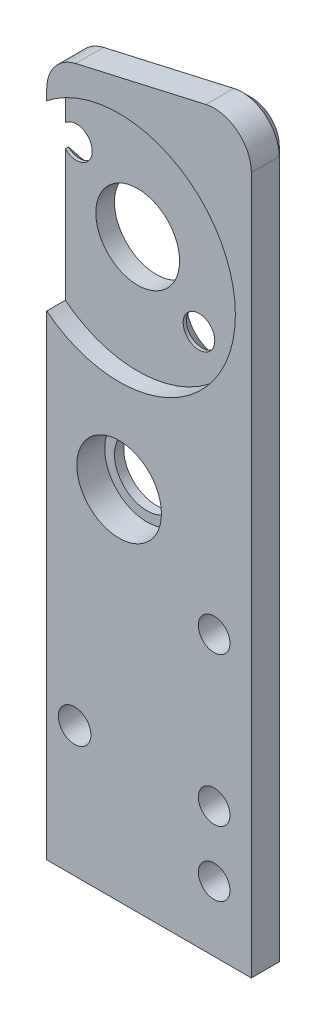
from build123d import *

# Parameters (mm, degrees)
RESSALTO_EXTRUS_O1_DEPTH                             = 4
FILETE1_R                                            = 4
CHANFRO1_SIZE                                        = 1
FURO_DE_DI_METRO_7_0_7_1_D                           = 7
ESCAREADO_PARA_PARAFUSO_COM_CABE_A_ESCAR_D           = 3.4
ESCAREADO_PARA_PARAFUSO_COM_CABE_A_ESCAR_CSINK_D     = 6.3
ESCAREADO_PARA_PARAFUSO_COM_CABE_A_ESCAR_CSINK_ANGLE = 90
BROCA_DE_ROSQUEAR_PARA_TARRAXA_DE_M21_D              = 1.6
BROCA_DE_ROSQUEAR_PARA_TARRAXA_DE_M21_DEPTH          = 8
BROCA_DE_ROSQUEAR_PARA_TARRAXA_DE_M21_TIP            = 0.480688495
FURO_DE_DI_METRO_9_0_9_3_D                           = 9
ESCAREADO_PARA_PARAFUSO_ALLEN_SEXTAVADO_D            = 3.4
ESCAREADO_PARA_PARAFUSO_ALLEN_SEXTAVADO_CSINK_D      = 6.72
ESCAREADO_PARA_PARAFUSO_ALLEN_SEXTAVADO_CSINK_ANGLE  = 90
ESCAREADO_PARA_PARAFUSO_COM_CABE_A_E_2_D             = 3.4
ESCAREADO_PARA_PARAFUSO_COM_CABE_A_E_2_DEPTH         = 4
ESCAREADO_PARA_PARAFUSO_COM_CABE_A_E_2_CSINK_D       = 6.3
ESCAREADO_PARA_PARAFUSO_COM_CABE_A_E_2_CSINK_ANGLE   = 90
ESCAREADO_PARA_PARAFUSO_COM_CABE_A_E_2_TIP           = 1.021463052
ESBO_O12_R                                           = 4.55
CORTE_EXTRUS_O1_DEPTH                                = 3
FURO_DE_DI_METRO_3_5_3_5_1_D                         = 3.5
ESBO_O36_R                                           = 12.5
CORTE_EXTRUS_O4_DEPTH                                = 2


with BuildPart() as part:
    # Esboço1 → Ressalto-extrusão1 (new body)
    with BuildSketch(Plane.XY):
        Polygon((0, 0), (22, 0), (22, 80), (0, 75), align=None)
    extrude(amount=RESSALTO_EXTRUS_O1_DEPTH)

    # Filete1
    filete1_edges = [part.edges().sort_by_distance(p)[0] for p in [
        (0, 75, 2),
        (22, 80, 2),
    ]]
    fillet(filete1_edges, radius=FILETE1_R)

    # Chanfro1
    chanfro1_edges = [part.edges().sort_by_distance(p)[0] for p in [
        (10.113515586, 77.298526269, 0),
        (0, 35.903542878, 0),
        (0.873825208, 74.302487761, 0),
        (20.495402006, 78.115078729, 0),
        (22, 37.494451969, 0),
    ]]
    chamfer(chanfro1_edges, length=CHANFRO1_SIZE)

    # Furo de diâmetro Ø7.0 (7)1 (through all)
    with Locations(Plane(origin=(7.780869527, 38.393713373, 0), x_dir=(-1, 0, 0), z_dir=(0, 0, -1))):
        with Locations((0, 0)):
            Hole(FURO_DE_DI_METRO_7_0_7_1_D / 2)

    # Escareado para parafuso com cabe_a escar (through all)
    with Locations(Plane(origin=(18, 7, 0), x_dir=(-1, 0, 0), z_dir=(0, 0, -1))):
        with Locations((0, 0), (0, 7)):
            CounterSinkHole(ESCAREADO_PARA_PARAFUSO_COM_CABE_A_ESCAR_D / 2, ESCAREADO_PARA_PARAFUSO_COM_CABE_A_ESCAR_CSINK_D / 2, counter_sink_angle=ESCAREADO_PARA_PARAFUSO_COM_CABE_A_ESCAR_CSINK_ANGLE)

    # Broca de rosquear para tarraxa de M21
    with Locations(Plane(origin=(4, 0, 2), x_dir=(0, 0, -1), z_dir=(0, -1, 0))):
        with Locations((0, 0), (0, 8)):
            Hole(BROCA_DE_ROSQUEAR_PARA_TARRAXA_DE_M21_D / 2, depth=BROCA_DE_ROSQUEAR_PARA_TARRAXA_DE_M21_DEPTH)
            with Locations((0, 0, -(BROCA_DE_ROSQUEAR_PARA_TARRAXA_DE_M21_DEPTH + BROCA_DE_ROSQUEAR_PARA_TARRAXA_DE_M21_TIP / 2))):  # 118° drill point
                Cone(0, BROCA_DE_ROSQUEAR_PARA_TARRAXA_DE_M21_D / 2, BROCA_DE_ROSQUEAR_PARA_TARRAXA_DE_M21_TIP, mode=Mode.SUBTRACT)

    # Furo de diâmetro Ø9.0 (9)3 (through all)
    with Locations(Plane(origin=(7.780869527, 60.893713373, 0), x_dir=(-1, 0, 0), z_dir=(0, 0, -1))):
        with Locations((0, 0)):
            Hole(FURO_DE_DI_METRO_9_0_9_3_D / 2)

    # Escareado para parafuso Allen sextavado escareado de M31 (through all)
    with Locations(Plane(origin=(14.368851738, 55.36573993, 0), x_dir=(-1, 0, 0), z_dir=(0, 0, -1))):
        with Locations((0, 0), (13.175964422, 11.055946886)):
            CounterSinkHole(ESCAREADO_PARA_PARAFUSO_ALLEN_SEXTAVADO_D / 2, ESCAREADO_PARA_PARAFUSO_ALLEN_SEXTAVADO_CSINK_D / 2, counter_sink_angle=ESCAREADO_PARA_PARAFUSO_ALLEN_SEXTAVADO_CSINK_ANGLE)

    # Escareado para parafuso com cabe_a e 2
    with Locations(Plane(origin=(18, 30, 0), x_dir=(-1, 0, 0), z_dir=(0, 0, -1))):
        with Locations((0, 0)):
            CounterSinkHole(ESCAREADO_PARA_PARAFUSO_COM_CABE_A_E_2_D / 2, ESCAREADO_PARA_PARAFUSO_COM_CABE_A_E_2_CSINK_D / 2, depth=ESCAREADO_PARA_PARAFUSO_COM_CABE_A_E_2_DEPTH, counter_sink_angle=ESCAREADO_PARA_PARAFUSO_COM_CABE_A_E_2_CSINK_ANGLE)
            with Locations((0, 0, -(ESCAREADO_PARA_PARAFUSO_COM_CABE_A_E_2_DEPTH + ESCAREADO_PARA_PARAFUSO_COM_CABE_A_E_2_TIP / 2))):  # 118° drill point
                Cone(0, ESCAREADO_PARA_PARAFUSO_COM_CABE_A_E_2_D / 2, ESCAREADO_PARA_PARAFUSO_COM_CABE_A_E_2_TIP, mode=Mode.SUBTRACT)

    # Esboço12 → Corte-extrusão1 (cut)
    with BuildSketch(Plane.XY.offset(4)):
        with Locations((7.780869527, 38.393713373)):
            Circle(ESBO_O12_R)
    extrude(amount=-CORTE_EXTRUS_O1_DEPTH, mode=Mode.SUBTRACT)

    # Furo de diâmetro Ø3.5 (3.5)1 (through all)
    with Locations(Plane(origin=(3, 14, 0), x_dir=(-1, 0, 0), z_dir=(0, 0, -1))):
        with Locations((0, 0)):
            Hole(FURO_DE_DI_METRO_3_5_3_5_1_D / 2)

    # Esboço36 → Corte-extrusão4 (cut)
    with BuildSketch(Plane.XY.offset(4)):
        with Locations((7.780869527, 60.893713373)):
            Circle(ESBO_O36_R)
    extrude(amount=-CORTE_EXTRUS_O4_DEPTH, mode=Mode.SUBTRACT)


solid = part.part
